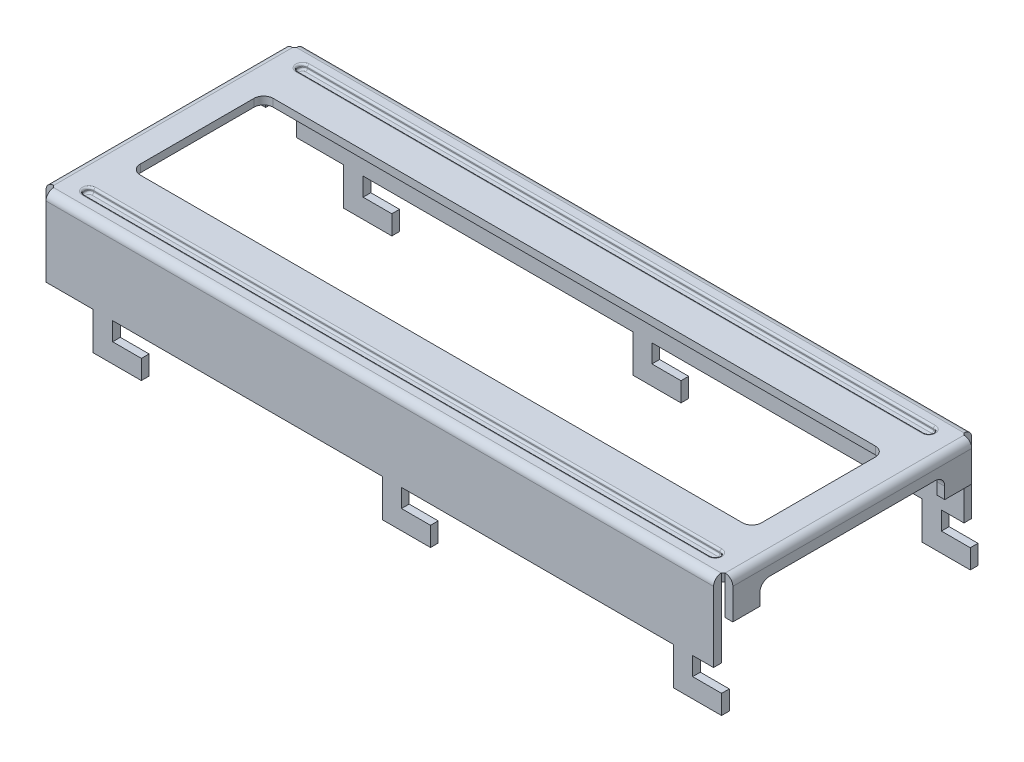
from build123d import *

# Parameters (mm, degrees)
SKETCH1_W            = 71.3
SKETCH1_H            = 26.8
BOSS_EXTRUDE1_DEPTH  = 0.8
SKETCH2_W            = 71.3
SKETCH2_H            = 26.8
SKETCH2_W_2          = 69.7
SKETCH2_H_2          = 25.2
BOSS_EXTRUDE2_DEPTH  = 7.3
CUT_EXTRUDE1_DEPTH   = 73.91460759
CUT_EXTRUDE4_DEPTH   = 46.193500639
CUT_EXTRUDE5_DEPTH   = 39.937032501
SKETCH13_W           = 2
SKETCH13_H           = 0.8
SKETCH13_W_2         = 1.982692709
SKETCH13_W_3         = 2.017307291
BITIS_DEPTH          = 1.9
SKETCH14_W           = 5
SKETCH14_H           = 0.8
COKOR_DEPTH          = 2
CUT_EXTRUDE6_DEPTH   = 0.5
FILLET1_R            = 0.2
FILLET1_OF_MIRROR1_R = 0.2
CUT_EXTRUDE7_REACH   = 41.931


with BuildPart() as part:
    # Sketch1 → Boss-Extrude1 (new body)
    with BuildSketch(Plane(origin=(0, 0, 0), x_dir=(1, 0, 0), z_dir=(0, 1, 0))):
        Rectangle(SKETCH1_W, SKETCH1_H)
    extrude(amount=BOSS_EXTRUDE1_DEPTH)

    # Sketch2 → Boss-Extrude2 (add)
    with BuildSketch(Plane.XZ):
        Rectangle(SKETCH2_W, SKETCH2_H)
        Rectangle(SKETCH2_W_2, SKETCH2_H_2, mode=Mode.SUBTRACT)
    extrude(amount=BOSS_EXTRUDE2_DEPTH)

    # Sketch5 → Cut-Extrude1 (cut, through all)
    with BuildSketch(Plane.ZY.offset(35.65)):
        with BuildLine():
            Line((-12.4, 0), (-12.6, 0))
            Line((-12.6, 0), (-12.6, -7.3))
            Line((-12.6, -7.3), (12.6, -7.3))
            Line((12.6, -7.3), (12.6, 0))
            Line((12.6, 0), (12.4, 0))
            Line((12.4, 0), (12.4, -3.2))
            Line((12.4, -3.2), (9.6, -3.2))
            Line((9.6, -3.2), (9.6, -2))
            ThreePointArc((9.6, -2), (9.307106781, -1.292893219), (8.6, -1))
            Line((8.6, -1), (-8.6, -1))
            ThreePointArc((-8.6, -1), (-9.307106781, -1.292893219), (-9.6, -2))
            Line((-9.6, -2), (-9.6, -3.2))
            Line((-9.6, -3.2), (-12.4, -3.2))
            Line((-12.4, -3.2), (-12.4, 0))
        make_face()
        with BuildLine():
            Line((13.4, 0.8), (13.4, 0))
            ThreePointArc((13.4, 0), (13.165685425, 0.565685425), (12.6, 0.8))
            Line((12.6, 0.8), (13.4, 0.8))
        make_face()
        with BuildLine():
            Line((-12.6, 0.8), (-13.4, 0.8))
            Line((-13.4, 0.8), (-13.4, 0))
            ThreePointArc((-13.4, 0), (-13.165685425, 0.565685425), (-12.6, 0.8))
        make_face()
    extrude(amount=-CUT_EXTRUDE1_DEPTH, mode=Mode.SUBTRACT)

    # Sketch9 → Cut-Extrude4 (cut, through all)
    with BuildSketch(Plane.XY.offset(13.4)):
        with BuildLine():
            ThreePointArc((-34.85, 0.8), (-35.415685425, 0.565685425), (-35.65, 0))
            Line((-35.65, 0), (-35.65, 0.8))
            Line((-35.65, 0.8), (-34.85, 0.8))
        make_face()
        Polygon((-34.65, 0), (-34.85, 0), (-34.85, -3.2), (-35.65, -3.2), (-35.65, -7.3), (-34.65, -7.3), align=None)
        Polygon((34.85, 0), (34.65, 0), (34.65, -7.3), (35.65, -7.3), (35.65, -3.2), (34.85, -3.2), align=None)
        with BuildLine():
            Line((35.65, 0.8), (35.65, 0))
            ThreePointArc((35.65, 0), (35.415685425, 0.565685425), (34.85, 0.8))
            Line((34.85, 0.8), (35.65, 0.8))
        make_face()
    extrude(amount=-CUT_EXTRUDE4_DEPTH, mode=Mode.SUBTRACT)

    # Sketch10 → Cut-Extrude5 (cut, through all)
    with BuildSketch(Plane(origin=(0, 0.8, 0), x_dir=(1, 0, 0), z_dir=(0, 1, 0))):
        Polygon((-34.65, -12.6), (-34.65, -13.4), (-35.65, -13.4), (-35.65, -12.4), (-34.85, -12.4), align=None)
        Polygon((35.65, -13.4), (34.65, -13.4), (34.65, -12.6), (34.85, -12.4), (35.65, -12.4), align=None)
        Polygon((34.65, 12.6), (34.65, 13.4), (35.65, 13.4), (35.65, 12.4), (34.85, 12.4), align=None)
        Polygon((-35.65, 13.4), (-34.65, 13.4), (-34.65, 12.6), (-34.85, 12.4), (-35.65, 12.4), align=None)
    extrude(amount=-CUT_EXTRUDE5_DEPTH, mode=Mode.SUBTRACT)

    # Sketch13 → Bitis (add)
    with BuildSketch(Plane.XZ.offset(7.3)):
        with Locations((31.479809087, 13)):
            Rectangle(SKETCH13_W, SKETCH13_H)
        with Locations((31.302010091, -13)):
            Rectangle(SKETCH13_W, SKETCH13_H)
        with Locations((1.258653645, -13)):
            Rectangle(SKETCH13_W_2, SKETCH13_H)
        with Locations((-28.741346355, 13)):
            Rectangle(SKETCH13_W_3, SKETCH13_H)
        with Locations((1.258653645, 13)):
            Rectangle(SKETCH13_W_2, SKETCH13_H)
        with Locations((-28.741346355, -13)):
            Rectangle(SKETCH13_W_3, SKETCH13_H)
    extrude(amount=BITIS_DEPTH)

    # Sketch14 → Cokor (add)
    with BuildSketch(Plane.XZ.offset(9.2)):
        with Locations((-27.25, 13)):
            Rectangle(SKETCH14_W, SKETCH14_H)
        with Locations((2.767307291, -13)):
            Rectangle(SKETCH14_W, SKETCH14_H)
        with Locations((-27.25, -13)):
            Rectangle(SKETCH14_W, SKETCH14_H)
        with Locations((2.767307291, 13)):
            Rectangle(SKETCH14_W, SKETCH14_H)
        with Locations((32.979809087, 13)):
            Rectangle(SKETCH14_W, SKETCH14_H)
        with Locations((32.802010091, -13)):
            Rectangle(SKETCH14_W, SKETCH14_H)
    extrude(amount=COKOR_DEPTH)

    # Sketch15 → Cut-Extrude6 (cut)
    with BuildSketch(Plane(origin=(0, 0.8, 0), x_dir=(1, 0, 0), z_dir=(0, 1, 0))):
        with BuildLine():
            Line((-32.5, -10.588064309), (32.5, -10.588064309))
            ThreePointArc((32.5, -10.588064309), (33, -11.088064309), (32.5, -11.588064309))
            Line((32.5, -11.588064309), (-32.5, -11.588064309))
            ThreePointArc((-32.5, -11.588064309), (-33, -11.088064309), (-32.5, -10.588064309))
        make_face()
    cut_extrude6 = extrude(amount=-CUT_EXTRUDE6_DEPTH, mode=Mode.SUBTRACT)

    # Fillet1
    fillet1_edges = [part.edges().sort_by_distance(p)[0] for p in [
        (-33, 0.3, 11.088064309),
        (0, 0.3, 10.588064309),
        (33, 0.3, 11.088064309),
        (0, 0.3, 11.588064309),
        (-33, 0.8, 11.088064309),
        (0, 0.8, 11.588064309),
        (33, 0.8, 11.088064309),
        (0, 0.8, 10.588064309),
    ]]
    fillet(fillet1_edges, radius=FILLET1_R)

    # Mirror1: Cut-Extrude6 across plane
    add(cut_extrude6.mirror(Plane.XY), mode=Mode.SUBTRACT)

    # Fillet1 of Mirror1
    fillet1_of_mirror1_edges = [part.edges().sort_by_distance(p)[0] for p in [
        (-33, 0.3, -11.088064309),
        (0, 0.3, -10.588064309),
        (33, 0.3, -11.088064309),
        (0, 0.3, -11.588064309),
        (-33, 0.8, -11.088064309),
        (0, 0.8, -11.588064309),
        (33, 0.8, -11.088064309),
        (0, 0.8, -10.588064309),
    ]]
    fillet(fillet1_of_mirror1_edges, radius=FILLET1_OF_MIRROR1_R)

    # Sketch19 → Cut-Extrude7 (cut, up to next)
    with BuildSketch(Plane(origin=(0, 0.8, 0), x_dir=(1, 0, 0), z_dir=(0, 1, 0)), mode=Mode.PRIVATE) as cut_extrude7_sk1:
        with BuildLine():
            Line((-31.280382084, -6.979906863), (31.219617916, -6.979906863))
            ThreePointArc((31.219617916, -6.979906863), (31.926724698, -6.687013644), (32.219617916, -5.979906863))
            Line((32.219617916, -5.979906863), (32.219617916, 5.820093137))
            ThreePointArc((32.219617916, 5.820093137), (31.926724698, 6.527199918), (31.219617916, 6.820093137))
            Line((31.219617916, 6.820093137), (-31.280382084, 6.820093137))
            ThreePointArc((-31.280382084, 6.820093137), (-31.987488865, 6.527199918), (-32.280382084, 5.820093137))
            Line((-32.280382084, 5.820093137), (-32.280382084, -5.979906863))
            ThreePointArc((-32.280382084, -5.979906863), (-31.987488865, -6.687013644), (-31.280382084, -6.979906863))
        make_face()
    cut_extrude7_tool1 = extrude(cut_extrude7_sk1.sketch, amount=-CUT_EXTRUDE7_REACH, mode=Mode.PRIVATE) & part.part
    add(cut_extrude7_tool1.solids().sort_by_distance((-0.030382, 0.8, 0.079907))[0], mode=Mode.SUBTRACT)


solid = part.part
